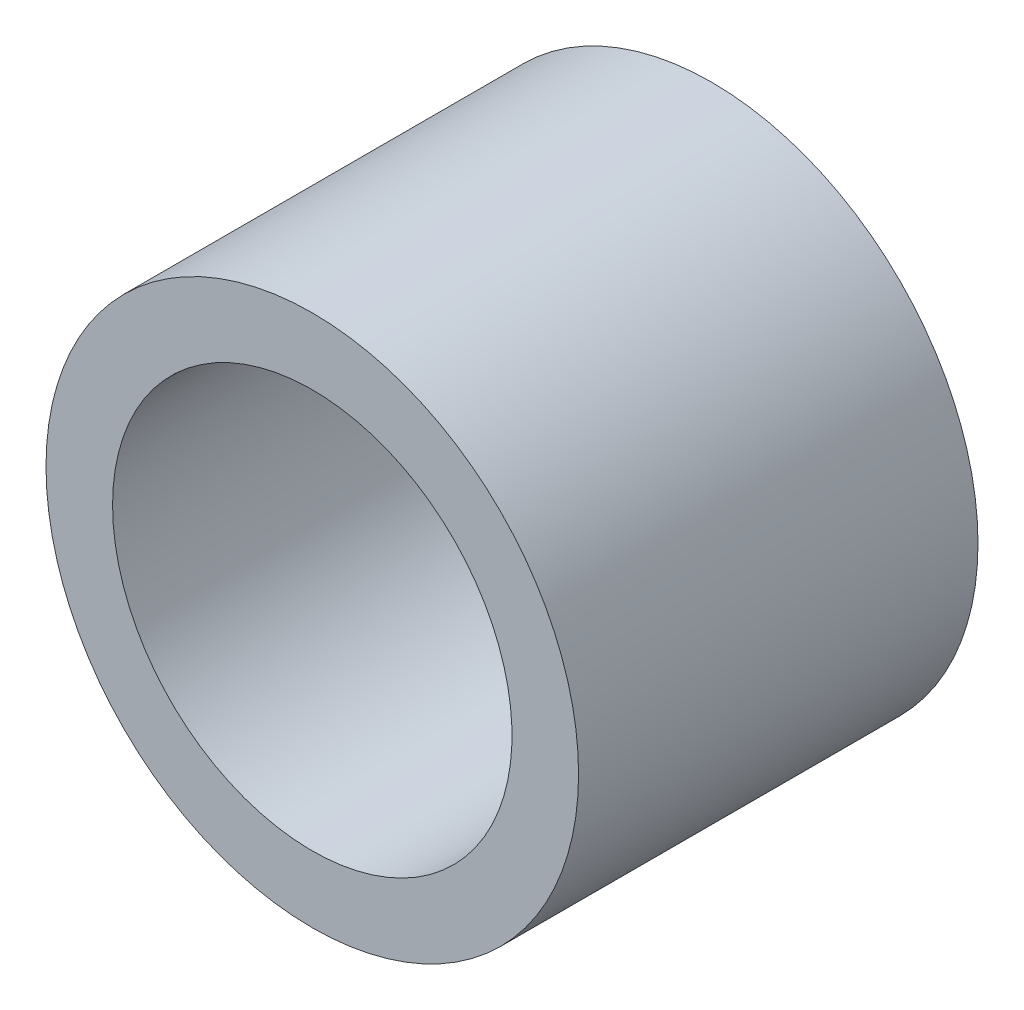
from build123d import *

# Parameters (mm, degrees)
SKETCH1_R           = 12.7
SKETCH1_R_2         = 9.525
BOSS_EXTRUDE1_DEPTH = 19.05


with BuildPart() as part:
    # Sketch1 → Boss-Extrude1 (new body)
    with BuildSketch(Plane.XY):
        with Locations(Location((0, 0, 0), (0, 0, 180))):
            Circle(SKETCH1_R)
        with Locations(Location((0, 0, 0), (0, 0, 180))):
            Circle(SKETCH1_R_2, mode=Mode.SUBTRACT)
    extrude(amount=BOSS_EXTRUDE1_DEPTH)


solid = part.part
